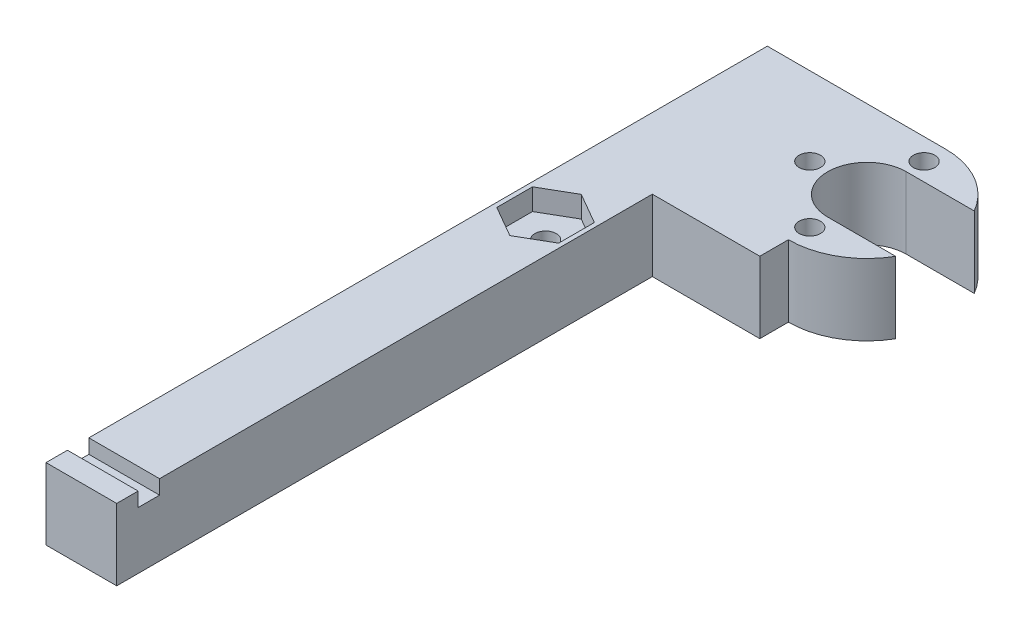
from build123d import *

# Parameters (mm, degrees)
SKETCH1_R           = 5.5
SKETCH1_R_2         = 1.5
BOSS_EXTRUDE1_DEPTH = 10
SKETCH2_W           = 9.9
SKETCH2_H           = 3
CUT_EXTRUDE1_DEPTH  = 2
SKETCH3_W           = 20.106266241
SKETCH3_H           = 11
CUT_EXTRUDE2_DEPTH  = 10
SKETCH4_R           = 1.5
CUT_EXTRUDE3_DEPTH  = 10
CUT_EXTRUDE4_DEPTH  = 3


with BuildPart() as part:
    # Sketch1 → Boss-Extrude1 (new body)
    with BuildSketch(Plane(origin=(0, 0, 0), x_dir=(1, 0, 0), z_dir=(0, 1, 0))):
        with BuildLine():
            Line((0, 0), (0, -75))
            Line((0, -75), (9.9, -75))
            Line((9.9, -75), (9.9, 0))
            Line((9.9, 0), (24.95, 0))
            Line((24.95, 0), (24.95, 4))
            ThreePointArc((24.95, 4), (35.95, 15), (24.95, 26))
            Line((24.95, 26), (0, 26))
            Line((0, 26), (0, 0))
        make_face()
        with Locations(Location((24.95, 15, 0), (0, 0, 270))):
            Circle(SKETCH1_R, mode=Mode.SUBTRACT)
        with Locations(Location((24.95, 23, 0), (0, 0, 270))):
            Circle(SKETCH1_R_2, mode=Mode.SUBTRACT)
        with Locations(Location((24.95, 7, 0), (0, 0, 270))):
            Circle(SKETCH1_R_2, mode=Mode.SUBTRACT)
        with Locations(Location((16.95, 15, 0), (0, 0, 270))):
            Circle(SKETCH1_R_2, mode=Mode.SUBTRACT)
    extrude(amount=BOSS_EXTRUDE1_DEPTH)

    # Sketch2 → Cut-Extrude1 (cut)
    with BuildSketch(Plane(origin=(0, 10, 0), x_dir=(1, 0, 0), z_dir=(0, 1, 0))):
        with Locations((4.95, -70.5)):
            Rectangle(SKETCH2_W, SKETCH2_H)
    extrude(amount=-CUT_EXTRUDE1_DEPTH, mode=Mode.SUBTRACT)

    # Sketch3 → Cut-Extrude2 (cut)
    with BuildSketch(Plane(origin=(0, 10, 0), x_dir=(1, 0, 0), z_dir=(0, 1, 0))):
        with Locations((35.003133121, 15)):
            Rectangle(SKETCH3_W, SKETCH3_H)
    extrude(amount=-CUT_EXTRUDE2_DEPTH, mode=Mode.SUBTRACT)

    # Sketch4 → Cut-Extrude3 (cut)
    with BuildSketch(Plane(origin=(0, 10, 0), x_dir=(1, 0, 0), z_dir=(0, 1, 0))):
        with Locations(Location((4.95, -10, 0), (0, 0, 270))):
            Circle(SKETCH4_R)
    extrude(amount=-CUT_EXTRUDE3_DEPTH, mode=Mode.SUBTRACT)

    # Sketch5 → Cut-Extrude4 (cut)
    with BuildSketch(Plane(origin=(0, 10, 0), x_dir=(1, 0, 0), z_dir=(0, 1, 0))):
        Polygon((4.95, -5), (0.619872981, -7.5), (0.619872981, -12.5), (4.95, -15), (9.280127019, -12.5), (9.280127019, -7.5), align=None)
    extrude(amount=-CUT_EXTRUDE4_DEPTH, mode=Mode.SUBTRACT)


solid = part.part
